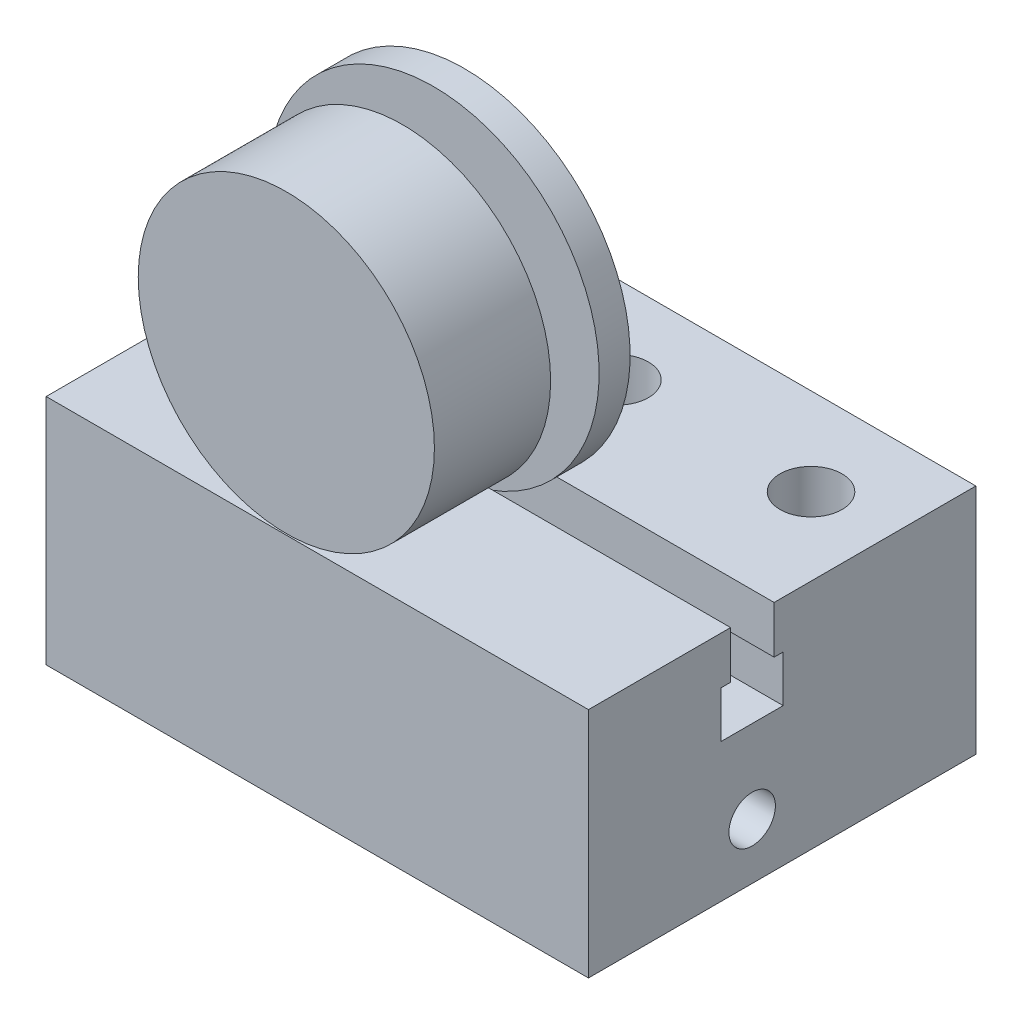
from build123d import *

# Parameters (mm, degrees)
SKETCH1_W           = 70
SKETCH1_H           = 50
SKETCH1_R           = 4
BOSS_EXTRUDE1_DEPTH = 30
SKETCH2_R           = 3
CUT_EXTRUDE1_DEPTH  = 71
SKETCH6_R           = 19.115114925
BOSS_EXTRUDE3_DEPTH = 15
SKETCH7_R           = 2
BOSS_EXTRUDE4_DEPTH = 4
SKETCH8_R           = 21.374545816
BOSS_EXTRUDE5_DEPTH = 4


with BuildPart() as part:
    # Sketch1 → Boss-Extrude1 (new body)
    with BuildSketch(Plane(origin=(0, 0, 0), x_dir=(1, 0, 0), z_dir=(0, 1, 0))):
        with Locations((45.25504703, 19.741860607)):
            Rectangle(SKETCH1_W, SKETCH1_H)
        with Locations(Location((45.25504703, 33.47585277, 0), (0, 0, 270))):
            Circle(SKETCH1_R, mode=Mode.SUBTRACT)
        with Locations(Location((70.25504538, 33.466769909, 0), (0, 0, 270))):
            Circle(SKETCH1_R, mode=Mode.SUBTRACT)
        with Locations(Location((20.255048319, 33.467826551, 0), (0, 0, 270))):
            Circle(SKETCH1_R, mode=Mode.SUBTRACT)
    extrude(amount=BOSS_EXTRUDE1_DEPTH)

    # Sketch2 → Cut-Extrude1 (cut)
    with BuildSketch(Plane.ZY.offset(-10.25504703)):
        with Locations((-15.87058853, 7.198699216)):
            Circle(SKETCH2_R)
        Polygon((-19.87058853, 17.881027255), (-11.87058853, 17.881027255), (-11.87058853, 23.881027255), (-13.086657096, 23.881027255), (-13.086657096, 30), (-18.703311227, 30), (-18.703311227, 23.881027255), (-19.87058853, 23.881027255), align=None)
    extrude(amount=-CUT_EXTRUDE1_DEPTH, mode=Mode.SUBTRACT)


with BuildPart() as body_2:
    # Sketch6 → Boss-Extrude3 (new body)
    with BuildSketch(Plane.XY.offset(5.258139393)):
        with Locations((41.25504703, 49.284939292)):
            Circle(SKETCH6_R)
    extrude(amount=-BOSS_EXTRUDE3_DEPTH)

    # Sketch7 → Boss-Extrude4 (add)
    with BuildSketch(Plane(origin=(0, 0, -9.741860607), x_dir=(-1, 0, 0), z_dir=(0, 0, -1))):
        with Locations(Location((-41.25504703, 49.284939292, 0), (0, 0, 180))):
            Circle(SKETCH7_R)
    extrude(amount=BOSS_EXTRUDE4_DEPTH)

    # Sketch8 → Boss-Extrude5 (add)
    with BuildSketch(Plane(origin=(0, 0, -13.741860607), x_dir=(-1, 0, 0), z_dir=(0, 0, -1))):
        with Locations((-41.25504703, 49.284939292)):
            Circle(SKETCH8_R)
    extrude(amount=BOSS_EXTRUDE5_DEPTH)


solid = Compound([part.part, body_2.part])
